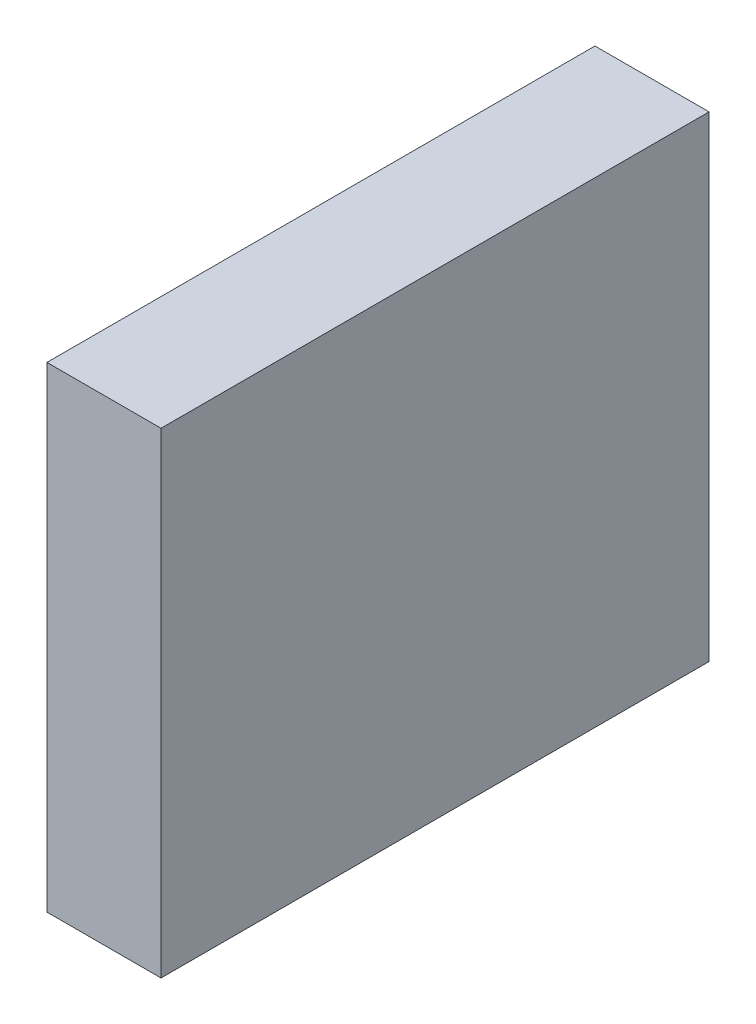
from build123d import *

# Parameters (mm, degrees)
SKETCH1_W           = 23
SKETCH1_H           = 110.5
BOSS_EXTRUDE1_DEPTH = 96


with BuildPart() as part:
    # Sketch1 → Boss-Extrude1 (new body)
    with BuildSketch(Plane(origin=(0, 0, 0), x_dir=(1, 0, 0), z_dir=(0, 1, 0))):
        with Locations((11.5, 55.25)):
            Rectangle(SKETCH1_W, SKETCH1_H)
    extrude(amount=BOSS_EXTRUDE1_DEPTH)


solid = part.part
